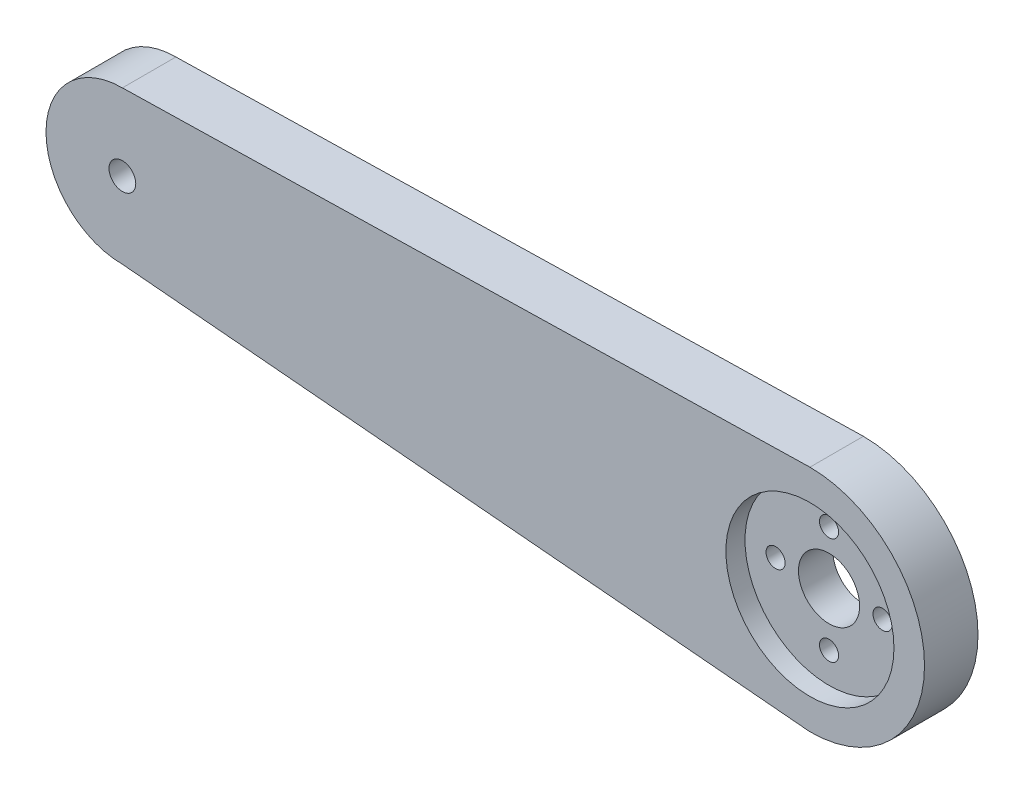
from build123d import *

# Parameters (mm, degrees)
EXTRUDE_1_DEPTH     = 7
SKETCH_2_R          = 4.1
SKETCH_2_R_2        = 1.25
SKETCH_2_R_3        = 4
CUT_EXTRUDE_1_DEPTH = 10
SKETCH_3_R          = 11
CUT_EXTRUDE_2_DEPTH = 2.5
SKETCH_7_R          = 4.1
EXTRUDE_4_DEPTH     = 7
SKETCH_13_R         = 1.75
CUT_EXTRUDE_3_DEPTH = 10
SKETCH_15_R         = 4.01
CUT_EXTRUDE_5_DEPTH = 3


with BuildPart() as part:
    # 草图1 → 凸台-拉伸1 (new body)
    with BuildSketch(Plane.XY):
        with BuildLine():
            Line((0, -10), (90, -18))
            ThreePointArc((90, -18), (105, -3), (90, 12))
            Line((90, 12), (0, 10))
            ThreePointArc((0, 10), (-10, 0), (0, -10))
        make_face()
    extrude(amount=EXTRUDE_1_DEPTH)

    # 草图2 → 切除-拉伸1 (cut)
    with BuildSketch(Plane(origin=(0, 0, 0), x_dir=(-1, 0, 0), z_dir=(0, 0, -1))):
        Circle(SKETCH_2_R)
        with Locations((-90, -10)):
            Circle(SKETCH_2_R_2)
        with Locations((-83, -3)):
            Circle(SKETCH_2_R_2)
        with Locations((-90, 4)):
            Circle(SKETCH_2_R_2)
        with Locations((-97, -3)):
            Circle(SKETCH_2_R_2)
        with Locations((-90, -3)):
            Circle(SKETCH_2_R_3)
    extrude(amount=-CUT_EXTRUDE_1_DEPTH, mode=Mode.SUBTRACT)

    # 草图3 → 切除-拉伸2 (cut)
    with BuildSketch(Plane.XY.offset(7)):
        with Locations((90, -3)):
            Circle(SKETCH_3_R)
    extrude(amount=-CUT_EXTRUDE_2_DEPTH, mode=Mode.SUBTRACT)

    # 草图7 → 凸台-拉伸4 (add)
    with BuildSketch(Plane(origin=(0, 0, 0), x_dir=(-1, 0, 0), z_dir=(0, 0, -1))):
        Circle(SKETCH_7_R)
    extrude(amount=-EXTRUDE_4_DEPTH)

    # 草图13 → 切除-拉伸3 (cut)
    with BuildSketch(Plane.XY.offset(7)):
        Circle(SKETCH_13_R)
    extrude(amount=-CUT_EXTRUDE_3_DEPTH, mode=Mode.SUBTRACT)

    # 草图15 → 切除-拉伸5 (cut)
    with BuildSketch(Plane(origin=(0, 0, 0), x_dir=(-1, 0, 0), z_dir=(0, 0, -1))):
        Circle(SKETCH_15_R)
    extrude(amount=-CUT_EXTRUDE_5_DEPTH, mode=Mode.SUBTRACT)


solid = part.part
